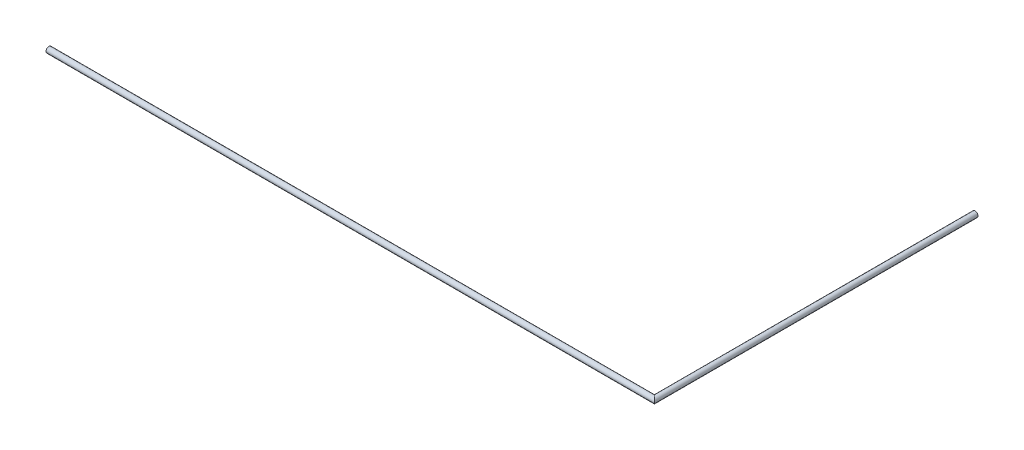
from build123d import *

# Parameters (mm, degrees)
CROQUIS1_R              = 12.7
SALIENTE_EXTRUIR1_DEPTH = 30
CROQUIS2_R              = 12.7


with BuildPart() as part:
    # Croquis1 → Saliente-Extruir1 (new body)
    with BuildSketch(Plane.XY):
        Circle(CROQUIS1_R)
    extrude(amount=SALIENTE_EXTRUIR1_DEPTH)

    # Barrer1: sweep along a curve in space
    with BuildLine() as barrer1_path:
        Line((0, 0, 30), (0, 0, 1430))
        Line((0, 0, 1430), (-2700, 0, 1430))
    # Croquis2 → Barrer1 (sweep)
    with BuildSketch(Plane.XY.offset(30)):
        Circle(CROQUIS2_R)
    sweep(path=barrer1_path.line, transition=Transition.RIGHT)


solid = part.part
